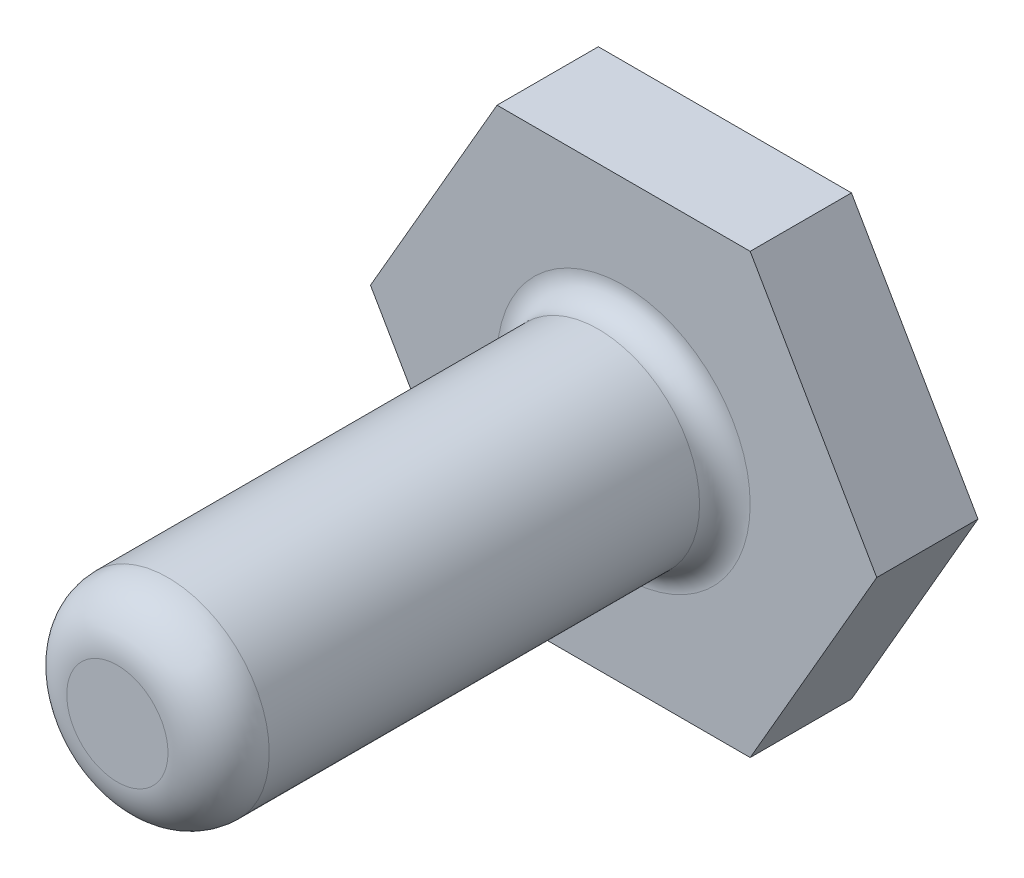
from build123d import *

# Parameters (mm, degrees)
BOSS_EXTRUDE1_DEPTH = 4
SKETCH2_R           = 4
BOSS_EXTRUDE2_DEPTH = 20
FILLET1_R           = 1
FILLET2_R           = 2


with BuildPart() as part:
    # Sketch1 → Boss-Extrude1 (new body)
    with BuildSketch(Plane.XY):
        Polygon((5, 8.660254038), (-5, 8.660254038), (-10, 0), (-5, -8.660254038), (5, -8.660254038), (10, 0), align=None)
    extrude(amount=BOSS_EXTRUDE1_DEPTH)

    # Sketch2 → Boss-Extrude2 (add)
    with BuildSketch(Plane.XY.offset(4)):
        Circle(SKETCH2_R)
    extrude(amount=BOSS_EXTRUDE2_DEPTH)

    # Fillet1
    fillet1_edges = [part.edges().sort_by_distance(p)[0] for p in [
        (-4, 0, 4),
    ]]
    fillet(fillet1_edges, radius=FILLET1_R)

    # Fillet2
    fillet2_edges = [part.edges().sort_by_distance(p)[0] for p in [
        (-4, 0, 24),
    ]]
    fillet(fillet2_edges, radius=FILLET2_R)


solid = part.part
